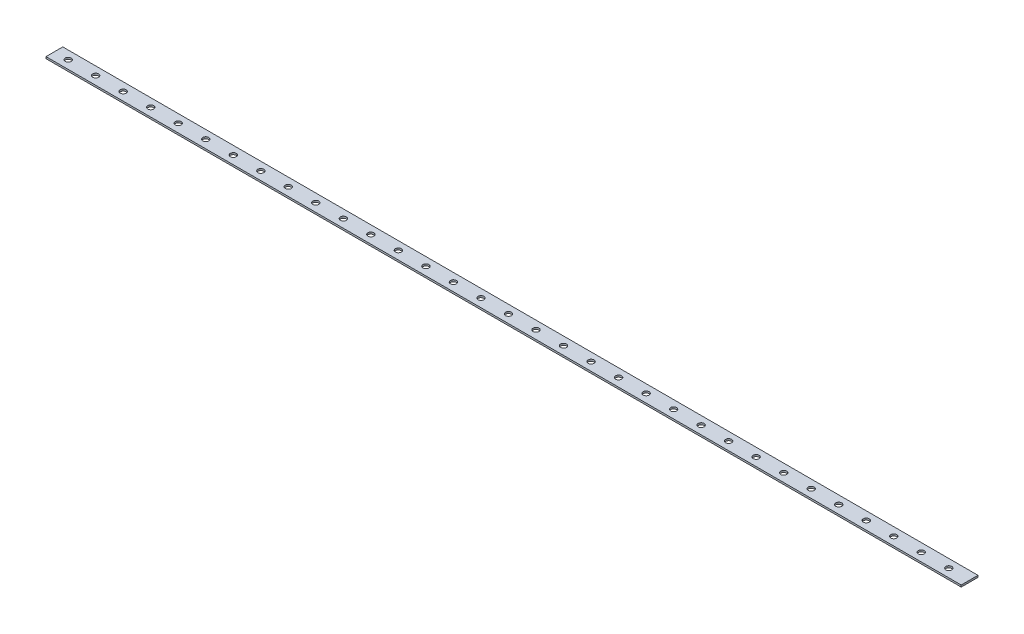
from build123d import *

# Parameters (mm, degrees)
SKETCH1_W           = 997.65
SKETCH1_H           = 18.3
SKETCH1_R           = 3.25
BOSS_EXTRUDE1_DEPTH = 1


with BuildPart() as part:
    # Sketch1 → Boss-Extrude1 (new, symmetric)
    with BuildSketch(Plane(origin=(0, 0, 0), x_dir=(1, 0, 0), z_dir=(0, 1, 0))):
        Rectangle(SKETCH1_W, SKETCH1_H)
        with Locations(Location((-483.825, 0, 0), (0, 0, 270))):
            Circle(SKETCH1_R, mode=Mode.SUBTRACT)
        with Locations(Location((-453.825, 0, 0), (0, 0, 270))):
            Circle(SKETCH1_R, mode=Mode.SUBTRACT)
        with Locations(Location((-423.825, 0, 0), (0, 0, 270))):
            Circle(SKETCH1_R, mode=Mode.SUBTRACT)
        with Locations(Location((-393.825, 0, 0), (0, 0, 270))):
            Circle(SKETCH1_R, mode=Mode.SUBTRACT)
        with Locations(Location((-363.825, 0, 0), (0, 0, 270))):
            Circle(SKETCH1_R, mode=Mode.SUBTRACT)
        with Locations(Location((-333.825, 0, 0), (0, 0, 270))):
            Circle(SKETCH1_R, mode=Mode.SUBTRACT)
        with Locations(Location((-303.825, 0, 0), (0, 0, 270))):
            Circle(SKETCH1_R, mode=Mode.SUBTRACT)
        with Locations(Location((-273.825, 0, 0), (0, 0, 270))):
            Circle(SKETCH1_R, mode=Mode.SUBTRACT)
        with Locations(Location((-243.825, 0, 0), (0, 0, 270))):
            Circle(SKETCH1_R, mode=Mode.SUBTRACT)
        with Locations(Location((-213.825, 0, 0), (0, 0, 270))):
            Circle(SKETCH1_R, mode=Mode.SUBTRACT)
        with Locations(Location((-183.825, 0, 0), (0, 0, 270))):
            Circle(SKETCH1_R, mode=Mode.SUBTRACT)
        with Locations(Location((-153.825, 0, 0), (0, 0, 270))):
            Circle(SKETCH1_R, mode=Mode.SUBTRACT)
        with Locations(Location((-123.825, 0, 0), (0, 0, 270))):
            Circle(SKETCH1_R, mode=Mode.SUBTRACT)
        with Locations(Location((-93.825, 0, 0), (0, 0, 270))):
            Circle(SKETCH1_R, mode=Mode.SUBTRACT)
        with Locations(Location((-63.825, 0, 0), (0, 0, 270))):
            Circle(SKETCH1_R, mode=Mode.SUBTRACT)
        with Locations(Location((-33.825, 0, 0), (0, 0, 270))):
            Circle(SKETCH1_R, mode=Mode.SUBTRACT)
        with Locations(Location((-3.825, 0, 0), (0, 0, 270))):
            Circle(SKETCH1_R, mode=Mode.SUBTRACT)
        with Locations(Location((26.175, 0, 0), (0, 0, 270))):
            Circle(SKETCH1_R, mode=Mode.SUBTRACT)
        with Locations(Location((56.175, 0, 0), (0, 0, 270))):
            Circle(SKETCH1_R, mode=Mode.SUBTRACT)
        with Locations(Location((86.175, 0, 0), (0, 0, 270))):
            Circle(SKETCH1_R, mode=Mode.SUBTRACT)
        with Locations(Location((116.175, 0, 0), (0, 0, 270))):
            Circle(SKETCH1_R, mode=Mode.SUBTRACT)
        with Locations(Location((146.175, 0, 0), (0, 0, 270))):
            Circle(SKETCH1_R, mode=Mode.SUBTRACT)
        with Locations(Location((176.175, 0, 0), (0, 0, 270))):
            Circle(SKETCH1_R, mode=Mode.SUBTRACT)
        with Locations(Location((206.175, 0, 0), (0, 0, 270))):
            Circle(SKETCH1_R, mode=Mode.SUBTRACT)
        with Locations(Location((236.175, 0, 0), (0, 0, 270))):
            Circle(SKETCH1_R, mode=Mode.SUBTRACT)
        with Locations(Location((266.175, 0, 0), (0, 0, 270))):
            Circle(SKETCH1_R, mode=Mode.SUBTRACT)
        with Locations(Location((296.175, 0, 0), (0, 0, 270))):
            Circle(SKETCH1_R, mode=Mode.SUBTRACT)
        with Locations(Location((326.175, 0, 0), (0, 0, 270))):
            Circle(SKETCH1_R, mode=Mode.SUBTRACT)
        with Locations(Location((356.175, 0, 0), (0, 0, 270))):
            Circle(SKETCH1_R, mode=Mode.SUBTRACT)
        with Locations(Location((386.175, 0, 0), (0, 0, 270))):
            Circle(SKETCH1_R, mode=Mode.SUBTRACT)
        with Locations(Location((416.175, 0, 0), (0, 0, 270))):
            Circle(SKETCH1_R, mode=Mode.SUBTRACT)
        with Locations(Location((446.175, 0, 0), (0, 0, 270))):
            Circle(SKETCH1_R, mode=Mode.SUBTRACT)
        with Locations(Location((476.175, 0, 0), (0, 0, 270))):
            Circle(SKETCH1_R, mode=Mode.SUBTRACT)
    extrude(amount=BOSS_EXTRUDE1_DEPTH, both=True)


solid = part.part
